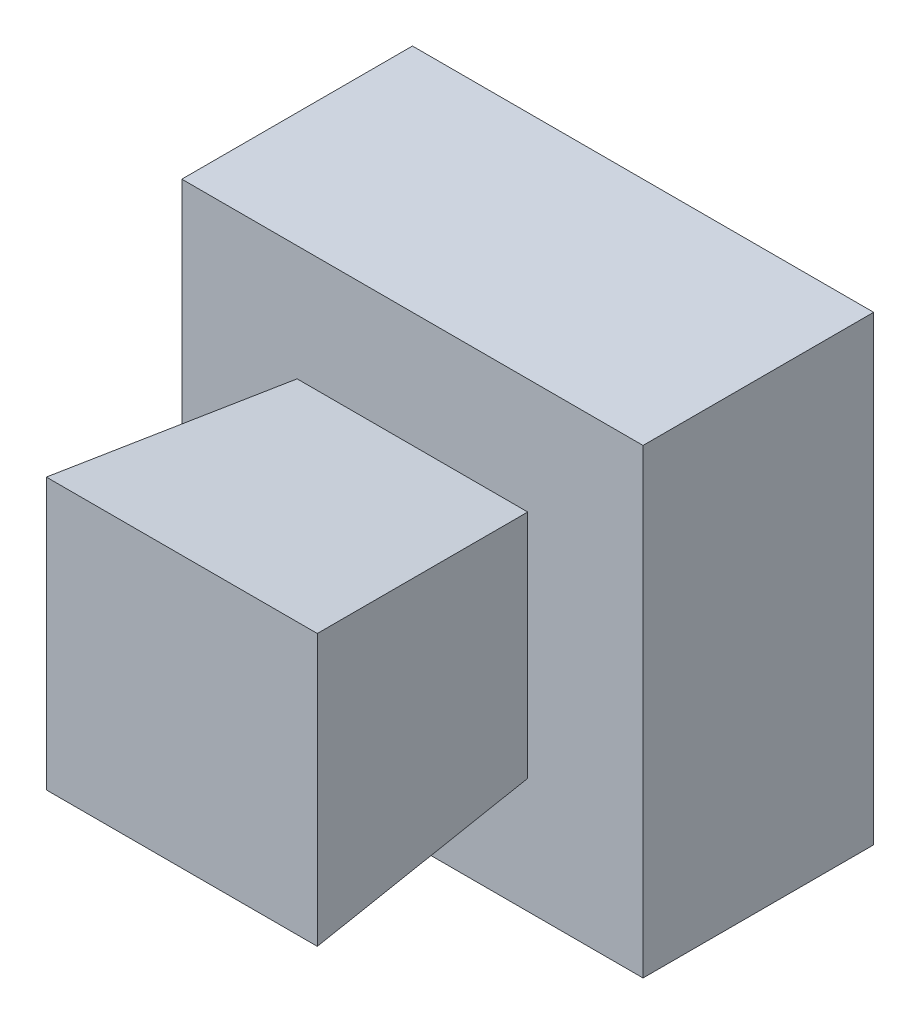
from build123d import *

# Parameters (mm, degrees)
SKETCH_1_W         = 20
SKETCH_1_H         = 20
BASEBOX_DEPTH      = 10
SKETCH_2_W         = 10
SKETCH_2_H         = 10
DRAFTOUTWARD_DEPTH = 10
DRAFTOUTWARD_DRAFT = -5


with BuildPart() as part:
    # 草图1 → BaseBox (new body)
    with BuildSketch(Plane.XY):
        with Locations((10, 10)):
            Rectangle(SKETCH_1_W, SKETCH_1_H)
    extrude(amount=BASEBOX_DEPTH)


with BuildPart() as draftoutward_tool:
    # 草图2 → DraftOutward (with draft: the straight prism first)
    with BuildSketch(Plane.XY.offset(10)):
        with Locations((10, 10)):
            Rectangle(SKETCH_2_W, SKETCH_2_H)
    extrude(amount=DRAFTOUTWARD_DEPTH)
    # DraftOutward: the draft: its side faces are tilted about the plane it starts from
    draftoutward_sides = [draftoutward_tool.faces().sort_by_distance(p)[0] for p in [
        (10, 5, 15),
        (15, 10, 15),
        (10, 15, 15),
        (5, 10, 15),
    ]]
    draft(draftoutward_sides, Plane.XY.offset(10), DRAFTOUTWARD_DRAFT)


with BuildPart() as part_1:
    add(part.part)

    # DraftOutward: add draftoutward_tool
    add(draftoutward_tool.part)


solid = part_1.part
